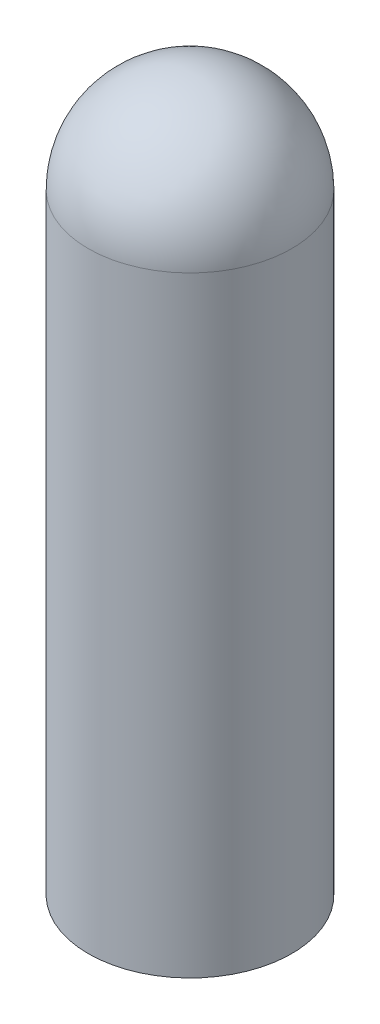
from build123d import *

# Parameters (mm, degrees)
SKETCH1_R           = 25.4
BOSS_EXTRUDE1_DEPTH = 152.4
SKETCH4_R           = 6.35
CUT_EXTRUDE1_DEPTH  = 175.26


with BuildPart() as part:
    # Sketch1 → Boss-Extrude1 (new body)
    with BuildSketch(Plane(origin=(0, 0, 0), x_dir=(1, 0, 0), z_dir=(0, 1, 0))):
        with Locations(Location((0, 0, 0), (0, 0, 90))):
            Circle(SKETCH1_R)
    extrude(amount=BOSS_EXTRUDE1_DEPTH)

    # Sketch2 → Revolve1 (revolve)
    with BuildSketch(Plane(origin=(0, 152.4, 0), x_dir=(1, 0, 0), z_dir=(0, 1, 0))):
        with BuildLine():
            Line((0, 25.4), (0, -25.4))
            ThreePointArc((0, -25.4), (-25.4, 0), (0, 25.4))
        make_face()
    revolve(axis=Axis((0, 152.4, -25.4), (0, 0, 1)))

    # Sketch4 → Cut-Extrude1 (cut)
    with BuildSketch(Plane.XZ):
        with Locations(Location((0, 0, 0), (0, 0, 270))):
            Circle(SKETCH4_R)
    extrude(amount=-CUT_EXTRUDE1_DEPTH, mode=Mode.SUBTRACT)


solid = part.part
